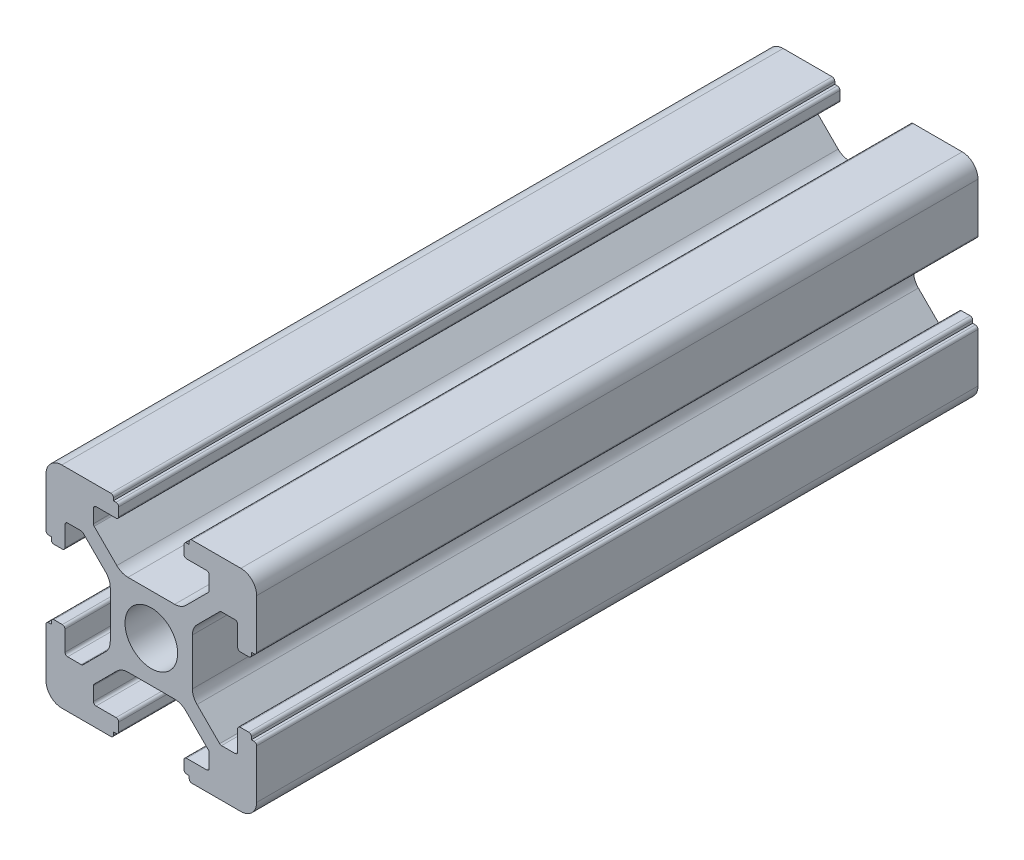
from build123d import *

# Parameters (mm, degrees)
SKETCH_1_R      = 2.5
EXTRUDE_1_DEPTH = 68.5


with BuildPart() as part:
    # 草图1 → 凸台-拉伸1 (new body)
    with BuildSketch(Plane.XY):
        with BuildLine():
            Line((-8.502261885, -10.002261885), (-3.85, -10.002261885))
            ThreePointArc((-3.85, -10.002261885), (-3.673223305, -9.929038581), (-3.6, -9.752261885))
            Line((-3.6, -9.752261885), (-3.6, -9.502261885))
            Line((-3.6, -9.502261885), (-3.35, -9.502261885))
            ThreePointArc((-3.35, -9.502261885), (-3.173223305, -9.429038581), (-3.1, -9.252261885))
            Line((-3.1, -9.252261885), (-3.1, -8.45))
            ThreePointArc((-3.1, -8.45), (-3.173223305, -8.273223305), (-3.35, -8.2))
            Line((-3.35, -8.2), (-5.25, -8.2))
            ThreePointArc((-5.25, -8.2), (-5.426776695, -8.126776695), (-5.5, -7.95))
            Line((-5.5, -7.95), (-5.5, -6.664213562))
            ThreePointArc((-5.5, -6.664213562), (-5.480969883, -6.568542704), (-5.426776695, -6.487436867))
            Line((-5.426776695, -6.487436867), (-3.278679656, -4.339339828))
            ThreePointArc((-3.278679656, -4.339339828), (-2.792044633, -4.014180701), (-2.218019485, -3.9))
            Line((-2.218019485, -3.9), (2.218019485, -3.9))
            ThreePointArc((2.218019485, -3.9), (2.792044633, -4.014180701), (3.278679656, -4.339339828))
            Line((3.278679656, -4.339339828), (5.426776695, -6.487436867))
            ThreePointArc((5.426776695, -6.487436867), (5.480969883, -6.568542704), (5.5, -6.664213562))
            Line((5.5, -6.664213562), (5.5, -7.95))
            ThreePointArc((5.5, -7.95), (5.426776695, -8.126776695), (5.25, -8.2))
            Line((5.25, -8.2), (3.35, -8.2))
            ThreePointArc((3.35, -8.2), (3.173223305, -8.273223305), (3.1, -8.45))
            Line((3.1, -8.45), (3.1, -9.252261885))
            ThreePointArc((3.1, -9.252261885), (3.173223305, -9.429038581), (3.35, -9.502261885))
            Line((3.35, -9.502261885), (3.6, -9.502261885))
            Line((3.6, -9.502261885), (3.6, -9.752261885))
            ThreePointArc((3.6, -9.752261885), (3.673223305, -9.929038581), (3.85, -10.002261885))
            Line((3.85, -10.002261885), (8.502261885, -10.002261885))
            ThreePointArc((8.502261885, -10.002261885), (9.562922057, -9.562922057), (10.002261885, -8.502261885))
            Line((10.002261885, -8.502261885), (10.002261885, -3.85))
            ThreePointArc((10.002261885, -3.85), (9.929038581, -3.673223305), (9.752261885, -3.6))
            Line((9.752261885, -3.6), (9.502261885, -3.6))
            Line((9.502261885, -3.6), (9.502261885, -3.35))
            ThreePointArc((9.502261885, -3.35), (9.429038581, -3.173223305), (9.252261885, -3.1))
            Line((9.252261885, -3.1), (8.45, -3.1))
            ThreePointArc((8.45, -3.1), (8.273223305, -3.173223305), (8.2, -3.35))
            Line((8.2, -3.35), (8.2, -5.25))
            ThreePointArc((8.2, -5.25), (8.126776695, -5.426776695), (7.95, -5.5))
            Line((7.95, -5.5), (6.664213562, -5.5))
            ThreePointArc((6.664213562, -5.5), (6.568542704, -5.480969883), (6.487436867, -5.426776695))
            Line((6.487436867, -5.426776695), (4.339339828, -3.278679656))
            ThreePointArc((4.339339828, -3.278679656), (4.014180701, -2.792044633), (3.9, -2.218019485))
            Line((3.9, -2.218019485), (3.9, 2.218019485))
            ThreePointArc((3.9, 2.218019485), (4.014180701, 2.792044633), (4.339339828, 3.278679656))
            Line((4.339339828, 3.278679656), (6.487436867, 5.426776695))
            ThreePointArc((6.487436867, 5.426776695), (6.568542704, 5.480969883), (6.664213562, 5.5))
            Line((6.664213562, 5.5), (7.95, 5.5))
            ThreePointArc((7.95, 5.5), (8.126776695, 5.426776695), (8.2, 5.25))
            Line((8.2, 5.25), (8.2, 3.35))
            ThreePointArc((8.2, 3.35), (8.273223305, 3.173223305), (8.45, 3.1))
            Line((8.45, 3.1), (9.252261885, 3.1))
            ThreePointArc((9.252261885, 3.1), (9.429038581, 3.173223305), (9.502261885, 3.35))
            Line((9.502261885, 3.35), (9.502261885, 3.6))
            Line((9.502261885, 3.6), (9.752261885, 3.6))
            ThreePointArc((9.752261885, 3.6), (9.929038581, 3.673223305), (10.002261885, 3.85))
            Line((10.002261885, 3.85), (10.002261885, 8.502261885))
            ThreePointArc((10.002261885, 8.502261885), (9.562922057, 9.562922057), (8.502261885, 10.002261885))
            Line((8.502261885, 10.002261885), (3.85, 10.002261885))
            ThreePointArc((3.85, 10.002261885), (3.673223305, 9.929038581), (3.6, 9.752261885))
            Line((3.6, 9.752261885), (3.6, 9.502261885))
            Line((3.6, 9.502261885), (3.35, 9.502261885))
            ThreePointArc((3.35, 9.502261885), (3.173223305, 9.429038581), (3.1, 9.252261885))
            Line((3.1, 9.252261885), (3.1, 8.45))
            ThreePointArc((3.1, 8.45), (3.173223305, 8.273223305), (3.35, 8.2))
            Line((3.35, 8.2), (5.25, 8.2))
            ThreePointArc((5.25, 8.2), (5.426776695, 8.126776695), (5.5, 7.95))
            Line((5.5, 7.95), (5.5, 6.664213562))
            ThreePointArc((5.5, 6.664213562), (5.480969883, 6.568542704), (5.426776695, 6.487436867))
            Line((5.426776695, 6.487436867), (3.278679656, 4.339339828))
            ThreePointArc((3.278679656, 4.339339828), (2.792044633, 4.014180701), (2.218019485, 3.9))
            Line((2.218019485, 3.9), (-2.218019485, 3.9))
            ThreePointArc((-2.218019485, 3.9), (-2.792044633, 4.014180701), (-3.278679656, 4.339339828))
            Line((-3.278679656, 4.339339828), (-5.426776695, 6.487436867))
            ThreePointArc((-5.426776695, 6.487436867), (-5.480969883, 6.568542704), (-5.5, 6.664213562))
            Line((-5.5, 6.664213562), (-5.5, 7.95))
            ThreePointArc((-5.5, 7.95), (-5.426776695, 8.126776695), (-5.25, 8.2))
            Line((-5.25, 8.2), (-3.35, 8.2))
            ThreePointArc((-3.35, 8.2), (-3.173223305, 8.273223305), (-3.1, 8.45))
            Line((-3.1, 8.45), (-3.1, 9.252261885))
            ThreePointArc((-3.1, 9.252261885), (-3.173223305, 9.429038581), (-3.35, 9.502261885))
            Line((-3.35, 9.502261885), (-3.6, 9.502261885))
            Line((-3.6, 9.502261885), (-3.6, 9.752261885))
            ThreePointArc((-3.6, 9.752261885), (-3.673223305, 9.929038581), (-3.85, 10.002261885))
            Line((-3.85, 10.002261885), (-8.502261885, 10.002261885))
            ThreePointArc((-8.502261885, 10.002261885), (-9.562922057, 9.562922057), (-10.002261885, 8.502261885))
            Line((-10.002261885, 8.502261885), (-10.002261885, 3.85))
            ThreePointArc((-10.002261885, 3.85), (-9.929038581, 3.673223305), (-9.752261885, 3.6))
            Line((-9.752261885, 3.6), (-9.502261885, 3.6))
            Line((-9.502261885, 3.6), (-9.502261885, 3.35))
            ThreePointArc((-9.502261885, 3.35), (-9.429038581, 3.173223305), (-9.252261885, 3.1))
            Line((-9.252261885, 3.1), (-8.45, 3.1))
            ThreePointArc((-8.45, 3.1), (-8.273223305, 3.173223305), (-8.2, 3.35))
            Line((-8.2, 3.35), (-8.2, 5.25))
            ThreePointArc((-8.2, 5.25), (-8.126776695, 5.426776695), (-7.95, 5.5))
            Line((-7.95, 5.5), (-6.664213562, 5.5))
            ThreePointArc((-6.664213562, 5.5), (-6.568542704, 5.480969883), (-6.487436867, 5.426776695))
            Line((-6.487436867, 5.426776695), (-4.339339828, 3.278679656))
            ThreePointArc((-4.339339828, 3.278679656), (-4.014180701, 2.792044633), (-3.9, 2.218019485))
            Line((-3.9, 2.218019485), (-3.9, -2.218019485))
            ThreePointArc((-3.9, -2.218019485), (-4.014180701, -2.792044633), (-4.339339828, -3.278679656))
            Line((-4.339339828, -3.278679656), (-6.487436867, -5.426776695))
            ThreePointArc((-6.487436867, -5.426776695), (-6.568542704, -5.480969883), (-6.664213562, -5.5))
            Line((-6.664213562, -5.5), (-7.95, -5.5))
            ThreePointArc((-7.95, -5.5), (-8.126776695, -5.426776695), (-8.2, -5.25))
            Line((-8.2, -5.25), (-8.2, -3.35))
            ThreePointArc((-8.2, -3.35), (-8.273223305, -3.173223305), (-8.45, -3.1))
            Line((-8.45, -3.1), (-9.252261885, -3.1))
            ThreePointArc((-9.252261885, -3.1), (-9.429038581, -3.173223305), (-9.502261885, -3.35))
            Line((-9.502261885, -3.35), (-9.502261885, -3.6))
            Line((-9.502261885, -3.6), (-9.752261885, -3.6))
            ThreePointArc((-9.752261885, -3.6), (-9.929038581, -3.673223305), (-10.002261885, -3.85))
            Line((-10.002261885, -3.85), (-10.002261885, -8.502261885))
            ThreePointArc((-10.002261885, -8.502261885), (-9.562922057, -9.562922057), (-8.502261885, -10.002261885))
        make_face()
        Circle(SKETCH_1_R, mode=Mode.SUBTRACT)
    extrude(amount=EXTRUDE_1_DEPTH)


solid = part.part
